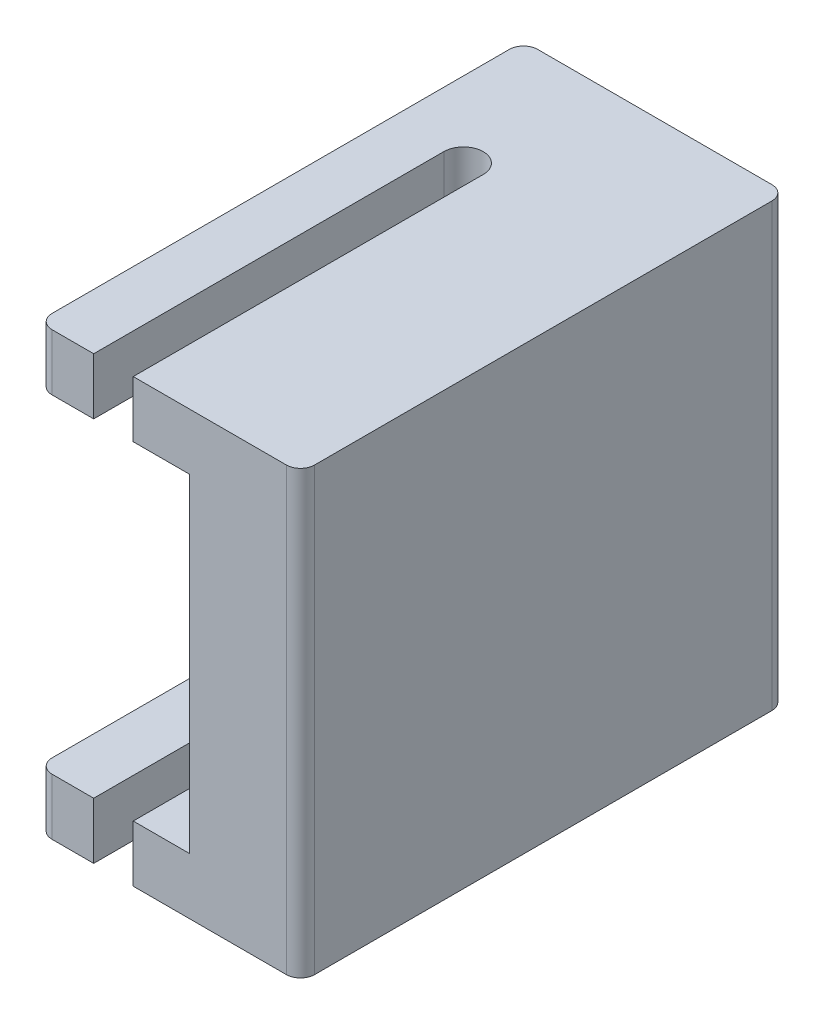
from build123d import *

# Parameters (mm, degrees)
BOSS_EXTRUDE1_DEPTH = 43
CUT_EXTRUDE2_DEPTH  = 101.611036298
FILLET1_R           = 2.5


with BuildPart() as part:
    # Sketch1 → Boss-Extrude1 (new, symmetric)
    with BuildSketch(Plane.XY):
        Polygon((-46.5, 39.0875), (-46.5, 29.0875), (-19.625, 29.0875), (-19.625, -29.0875), (-46.5, -29.0875), (-46.5, -39.0875), (0, -39.0875), (0, 39.0875), align=None)
    extrude(amount=BOSS_EXTRUDE1_DEPTH, both=True)

    # Sketch2 → Cut-Extrude2 (cut, through all)
    with BuildSketch(Plane(origin=(0, 39.0875, 0), x_dir=(1, 0, 0), z_dir=(0, 1, 0))):
        with BuildLine():
            Line((-36.625, -43), (-36.625, 19))
            ThreePointArc((-36.625, 19), (-33.125, 22.5), (-29.625, 19))
            Line((-29.625, 19), (-29.625, -43))
            Line((-29.625, -43), (-36.625, -43))
        make_face()
    extrude(amount=-CUT_EXTRUDE2_DEPTH, mode=Mode.SUBTRACT)

    # Fillet1
    fillet1_edges = [part.edges().sort_by_distance(p)[0] for p in [
        (-46.5, 34.0875, -43),
        (-46.5, -34.0875, 43),
        (0, 0, 43),
        (0, 0, -43),
        (-46.5, 34.0875, 43),
        (-46.5, -34.0875, -43),
    ]]
    fillet(fillet1_edges, radius=FILLET1_R)


solid = part.part
